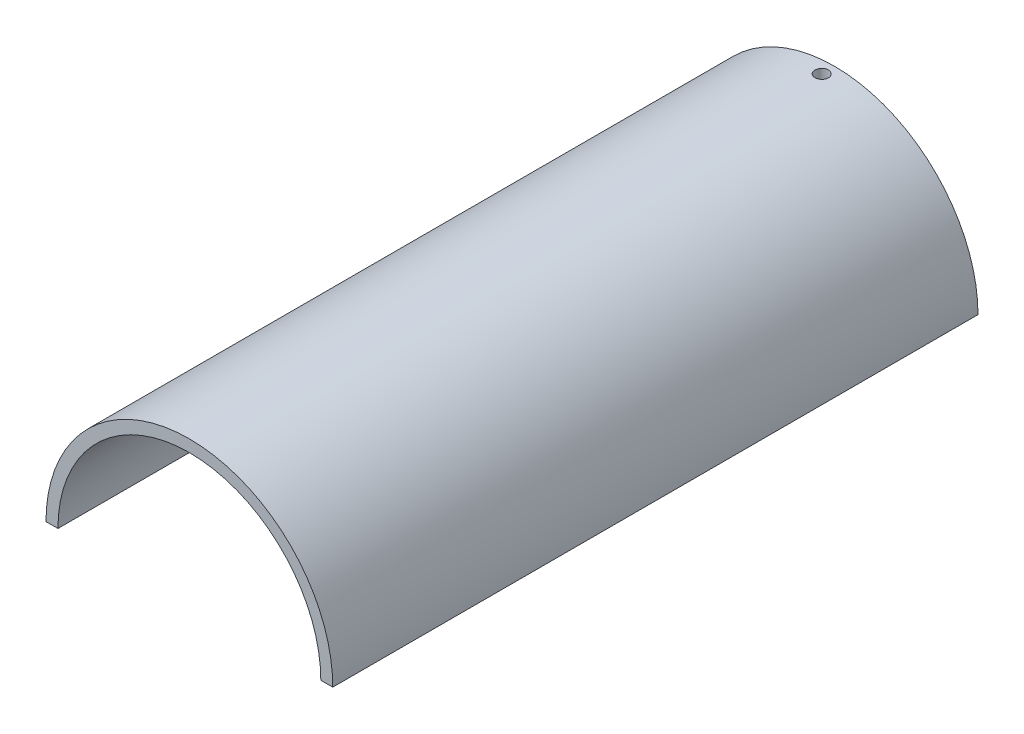
from build123d import *

# Parameters (mm, degrees)
BOSS_EXTRUDE1_DEPTH             = 171.45
F_9_64_0_14063_DIAMETER_HOLE1_D = 3.572002


with BuildPart() as part:
    # Sketch1 → Boss-Extrude1 (new body)
    with BuildSketch(Plane.XY):
        with BuildLine():
            Line((-38.1, 0), (-34.925, 0))
            ThreePointArc((-34.925, 0), (0, 34.925), (34.925, 0))
            Line((34.925, 0), (38.1, 0))
            ThreePointArc((38.1, 0), (0, 38.1), (-38.1, 0))
        make_face()
    extrude(amount=BOSS_EXTRUDE1_DEPTH)

    # 9/64 (0.14063) Diameter Hole1 (through all)
    with Locations(Plane(origin=(0, 38.1, 0), x_dir=(1, 0, 0), z_dir=(0, 1, 0))):
        with Locations((0, -3.44678)):
            Hole(F_9_64_0_14063_DIAMETER_HOLE1_D / 2)


solid = part.part
